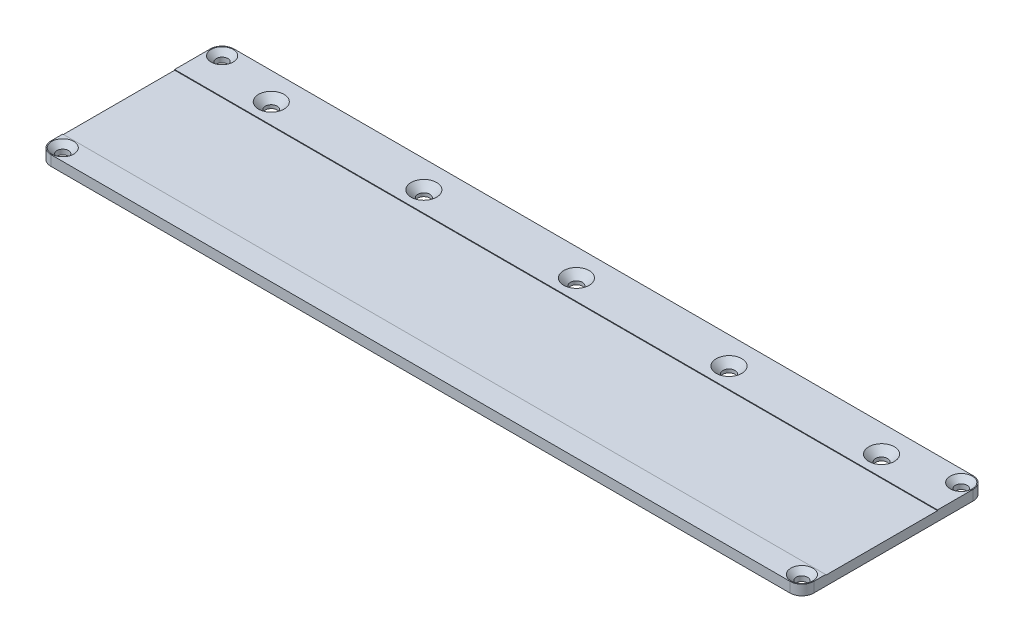
from build123d import *

# Parameters (mm, degrees)
SKETCH1_W                                    = 225
SKETCH1_H                                    = 47
SKETCH1_H_2                                  = 7
BOSS_EXTRUDE1_DEPTH                          = 3
SKETCH3_R                                    = 1.767766953
CUT_EXTRUDE1_DEPTH                           = 117.59974271
CHAMFER2_SIZE                                = 2
SKETCH2_W                                    = 225
SKETCH2_H                                    = 33
SKETCH2_R                                    = 15
CUT_EXTRUDE2_DEPTH                           = 0.2
FILLET1_R                                    = 3.5
CSK_FOR_M3_COUNTERSUNK_FLAT_HEAD_SCR_2_COUNT = 2
CSK_FOR_M3_COUNTERSUNK_FLAT_HEAD_SCR_2_PITCH = 47
CSK_FOR_M3_COUNTERSUNK_FLAT_HEAD_SCR_3_COUNT = 2
CSK_FOR_M3_COUNTERSUNK_FLAT_HEAD_SCR_3_PITCH = 223.00896843
CSK_FOR_M3_COUNTERSUNK_FLAT_HEAD_SCR_4_COUNT = 2
CSK_FOR_M3_COUNTERSUNK_FLAT_HEAD_SCR_4_PITCH = 218


with BuildPart() as part:
    # Sketch1 → Boss-Extrude1 (new body)
    with BuildSketch(Plane(origin=(0, 0, 0), x_dir=(1, 0, 0), z_dir=(0, 1, 0))):
        Rectangle(SKETCH1_W, SKETCH1_H)
        with Locations((0, -27)):
            Rectangle(SKETCH1_W, SKETCH1_H_2)
    extrude(amount=BOSS_EXTRUDE1_DEPTH)

    # Sketch3 → Cut-Extrude1 (cut, through all)
    with BuildSketch(Plane(origin=(0, 3, 0), x_dir=(1, 0, 0), z_dir=(0, 1, 0))):
        with Locations(Location((0, 15.5, 0), (0, 0, 270))):
            Circle(SKETCH3_R)
        with Locations(Location((45, 15.5, 0), (0, 0, 270))):
            Circle(SKETCH3_R)
        with Locations(Location((90, 15.5, 0), (0, 0, 270))):
            Circle(SKETCH3_R)
        with Locations(Location((-45, 15.5, 0), (0, 0, 270))):
            Circle(SKETCH3_R)
        with Locations(Location((-90, 15.5, 0), (0, 0, 270))):
            Circle(SKETCH3_R)
    extrude(amount=-CUT_EXTRUDE1_DEPTH, mode=Mode.SUBTRACT)

    # Chamfer2
    chamfer2_edges = [part.edges().sort_by_distance(p)[0] for p in [
        (-90, 3, -17.267766953),
        (-45, 3, -17.267766953),
        (90, 3, -17.267766953),
        (45, 3, -17.267766953),
        (0, 3, -17.267766953),
    ]]
    chamfer(chamfer2_edges, length=CHAMFER2_SIZE)

    # Sketch2 → Cut-Extrude2 (cut)
    # profile 1 of 6: a face of its own
    with BuildSketch(Plane(origin=(0, 3, 0), x_dir=(1, 0, 0), z_dir=(0, 1, 0))):
        with Locations((0, -7)):
            Rectangle(SKETCH2_W, SKETCH2_H)
        with Locations((-90, -7)):
            Circle(SKETCH2_R, mode=Mode.SUBTRACT)
        with Locations((-45, -7)):
            Circle(SKETCH2_R, mode=Mode.SUBTRACT)
        with Locations((0, -7)):
            Circle(SKETCH2_R, mode=Mode.SUBTRACT)
        with Locations((45, -7)):
            Circle(SKETCH2_R, mode=Mode.SUBTRACT)
        with Locations((90, -7)):
            Circle(SKETCH2_R, mode=Mode.SUBTRACT)
    # profile 2 of 6: a face of its own
    with BuildSketch(Plane(origin=(0, 3, 0), x_dir=(1, 0, 0), z_dir=(0, 1, 0))):
        with Locations((-90, -7)):
            Circle(SKETCH2_R)
    # profile 3 of 6: a face of its own
    with BuildSketch(Plane(origin=(0, 3, 0), x_dir=(1, 0, 0), z_dir=(0, 1, 0))):
        with Locations((-45, -7)):
            Circle(SKETCH2_R)
    # profile 4 of 6: a face of its own
    with BuildSketch(Plane(origin=(0, 3, 0), x_dir=(1, 0, 0), z_dir=(0, 1, 0))):
        with Locations((0, -7)):
            Circle(SKETCH2_R)
    # profile 5 of 6: a face of its own
    with BuildSketch(Plane(origin=(0, 3, 0), x_dir=(1, 0, 0), z_dir=(0, 1, 0))):
        with Locations((45, -7)):
            Circle(SKETCH2_R)
    # profile 6 of 6: a face of its own
    with BuildSketch(Plane(origin=(0, 3, 0), x_dir=(1, 0, 0), z_dir=(0, 1, 0))):
        with Locations((90, -7)):
            Circle(SKETCH2_R)
    extrude(amount=-CUT_EXTRUDE2_DEPTH, mode=Mode.SUBTRACT)

    # Fillet1
    fillet1_edges = [part.edges().sort_by_distance(p)[0] for p in [
        (112.5, 1.5, 30.5),
        (-112.5, 1.5, 30.5),
        (-112.5, 1.5, -23.5),
        (112.5, 1.5, -23.5),
    ]]
    fillet(fillet1_edges, radius=FILLET1_R)

    # Sketch5 → CSK for M3 Countersunk Flat Head Screw1 (revolve, cut)
    with BuildSketch(Plane(origin=(109, 3, -20), x_dir=(0, 0, 1), z_dir=(1, 0, 0))):
        Polygon((0, 0), (0, 3), (1.7, 3), (1.7, 1.55), (3.25, 0), align=None)
    csk_for_m3_countersunk_flat_head_screw1 = revolve(axis=Axis((109, 9.35, -20), (0, -1, 0)), mode=Mode.SUBTRACT)

    # CSK for M3 Countersunk Flat Head Scr 2: CSK for M3 Countersunk Flat Head Screw1 ×2
    with Locations(*[(0, 0, i * CSK_FOR_M3_COUNTERSUNK_FLAT_HEAD_SCR_2_PITCH) for i in range(1, CSK_FOR_M3_COUNTERSUNK_FLAT_HEAD_SCR_2_COUNT)]):
        add(csk_for_m3_countersunk_flat_head_screw1, mode=Mode.SUBTRACT)

    # CSK for M3 Countersunk Flat Head Scr 3: CSK for M3 Countersunk Flat Head Screw1 ×2
    with Locations(*[Vector(-0.977539161474997, 0, 0.21075385591433424) * (i * CSK_FOR_M3_COUNTERSUNK_FLAT_HEAD_SCR_3_PITCH) for i in range(1, CSK_FOR_M3_COUNTERSUNK_FLAT_HEAD_SCR_3_COUNT)]):
        add(csk_for_m3_countersunk_flat_head_screw1, mode=Mode.SUBTRACT)

    # CSK for M3 Countersunk Flat Head Scr 4: CSK for M3 Countersunk Flat Head Screw1 ×2
    with Locations(*[(-i * CSK_FOR_M3_COUNTERSUNK_FLAT_HEAD_SCR_4_PITCH, 0, 0) for i in range(1, CSK_FOR_M3_COUNTERSUNK_FLAT_HEAD_SCR_4_COUNT)]):
        add(csk_for_m3_countersunk_flat_head_screw1, mode=Mode.SUBTRACT)


solid = part.part
